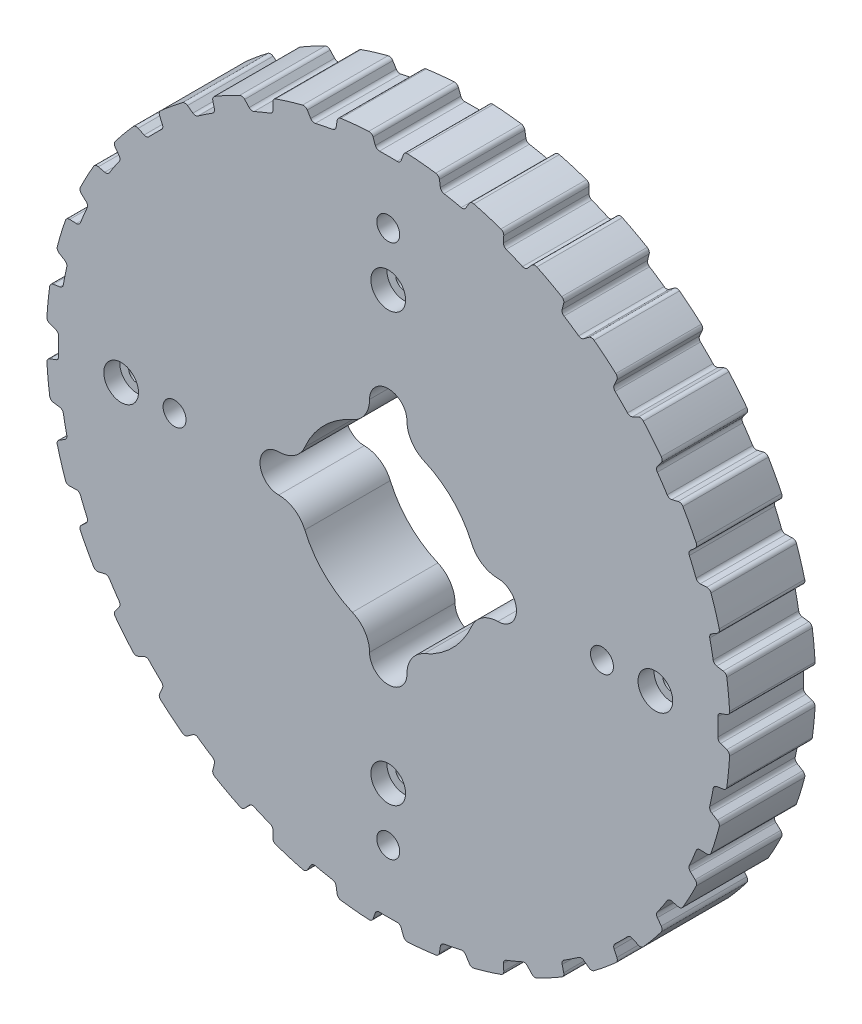
from build123d import *

# Parameters (mm, degrees)
SKETCH_1_R                   = 63.994568873
EXTRUDE_1_DEPTH              = 30
CUT_EXTRUDE_6_DEPTH          = 96.344688842
PATTERN_CIRCULAR_1_COUNT     = 32
CUT_EXTRUDE_START            = -16
SKETCH_1_7_R                 = 63.994568873
CUT_EXTRUDE_7_DEPTH          = 80.207245894
CUT_EXTRUDE_4_DEPTH          = 92.762844717
HOLE_WIZARD_M3_1_D           = 3.2
HOLE_WIZARD_M3_1_CBORE_D     = 6.5
HOLE_WIZARD_M3_1_CBORE_DEPTH = 3
HOLE_WIZARD_1_D              = 4.3


with BuildPart() as part:
    # ｽｹｯﾁ1 → ﾎﾞｽ - 押し出し1 (new body)
    with BuildSketch(Plane.XY):
        Circle(SKETCH_1_R)
    extrude(amount=-EXTRUDE_1_DEPTH)

    # ｽｹｯﾁ4 → ｶｯﾄ - 押し出し6 (cut, through all)
    with BuildSketch(Plane.XY):
        with BuildLine():
            Line((-2.844240519, 63.365789621), (-2.423059507, 62.208604302))
            ThreePointArc((-2.423059507, 62.208604302), (-2.121363458, 61.820822084), (-1.649914265, 61.682506456))
            ThreePointArc((-1.649914265, 61.682506456), (0, 61.704568873), (1.649914265, 61.682506456))
            ThreePointArc((1.649914265, 61.682506456), (2.121363458, 61.820822084), (2.423059507, 62.208604302))
            Line((2.423059507, 62.208604302), (2.844240519, 63.365789621))
            ThreePointArc((2.844240519, 63.365789621), (3.155971997, 63.760290333), (3.641517447, 63.890877251))
            ThreePointArc((3.641517447, 63.890877251), (0, 63.994568873), (-3.641517447, 63.890877251))
            ThreePointArc((-3.641517447, 63.890877251), (-3.155971997, 63.760290333), (-2.844240519, 63.365789621))
        make_face()
    cut_extrude_6 = extrude(amount=-CUT_EXTRUDE_6_DEPTH, mode=Mode.SUBTRACT)

    # 円形ﾊﾟﾀｰﾝ1: ｶｯﾄ - 押し出し6 ×32 about axis
    pattern_circular_1_axis = Axis((0, 0, -30), (0, 0, 1))
    for i in range(1, PATTERN_CIRCULAR_1_COUNT):
        add(cut_extrude_6.rotate(pattern_circular_1_axis, i * 360 / PATTERN_CIRCULAR_1_COUNT), mode=Mode.SUBTRACT)

    # ｽｹｯﾁ1<7> → ｶｯﾄ - 押し出し7 (cut, through all)
    with BuildSketch(Plane.XY.offset(CUT_EXTRUDE_START)):
        Circle(SKETCH_1_7_R)
    extrude(amount=-CUT_EXTRUDE_7_DEPTH, mode=Mode.SUBTRACT)

    # ｽｹｯﾁ1<4> → ｶｯﾄ - 押し出し4 (cut, through all)
    with BuildSketch(Plane.XY):
        with BuildLine():
            ThreePointArc((20.5, 3.5), (17.576901973, 4.37603633), (15.617427386, 6.715352697))
            ThreePointArc((15.617427386, 6.715352697), (12.02081528, 12.02081528), (6.715352697, 15.617427386))
            ThreePointArc((6.715352697, 15.617427386), (4.37603633, 17.576901973), (3.5, 20.5))
            ThreePointArc((3.5, 20.5), (0, 24), (-3.5, 20.5))
            ThreePointArc((-3.5, 20.5), (-4.37603633, 17.576901973), (-6.715352697, 15.617427386))
            ThreePointArc((-6.715352697, 15.617427386), (-12.02081528, 12.02081528), (-15.617427386, 6.715352697))
            ThreePointArc((-15.617427386, 6.715352697), (-17.576901973, 4.37603633), (-20.5, 3.5))
            ThreePointArc((-20.5, 3.5), (-24, 0), (-20.5, -3.5))
            ThreePointArc((-20.5, -3.5), (-17.576901973, -4.37603633), (-15.617427386, -6.715352697))
            ThreePointArc((-15.617427386, -6.715352697), (-12.02081528, -12.02081528), (-6.715352697, -15.617427386))
            ThreePointArc((-6.715352697, -15.617427386), (-4.37603633, -17.576901973), (-3.5, -20.5))
            ThreePointArc((-3.5, -20.5), (0, -24), (3.5, -20.5))
            ThreePointArc((3.5, -20.5), (4.37603633, -17.576901973), (6.715352697, -15.617427386))
            ThreePointArc((6.715352697, -15.617427386), (12.02081528, -12.02081528), (15.617427386, -6.715352697))
            ThreePointArc((15.617427386, -6.715352697), (17.576901973, -4.37603633), (20.5, -3.5))
            ThreePointArc((20.5, -3.5), (24, 0), (20.5, 3.5))
        make_face()
    extrude(amount=-CUT_EXTRUDE_4_DEPTH, mode=Mode.SUBTRACT)

    # M3 穴付きねじ用座ぐり穴1 (through all)
    with Locations(Plane(origin=(0, 40, 0), x_dir=(1, 0, 0), z_dir=(0, 0, 1))):
        with Locations((0, 0), (-50, -40), (0, -80), (50, -40)):
            CounterBoreHole(HOLE_WIZARD_M3_1_D / 2, HOLE_WIZARD_M3_1_CBORE_D / 2, HOLE_WIZARD_M3_1_CBORE_DEPTH)

    # Hole Wizard 1 (through all)
    with Locations(Plane(origin=(0, 50, 0), x_dir=(1, 0, 0), z_dir=(0, 0, 1))):
        with Locations((0, 0), (40, -50), (0, -100), (-40, -50)):
            Hole(HOLE_WIZARD_1_D / 2)


solid = part.part
